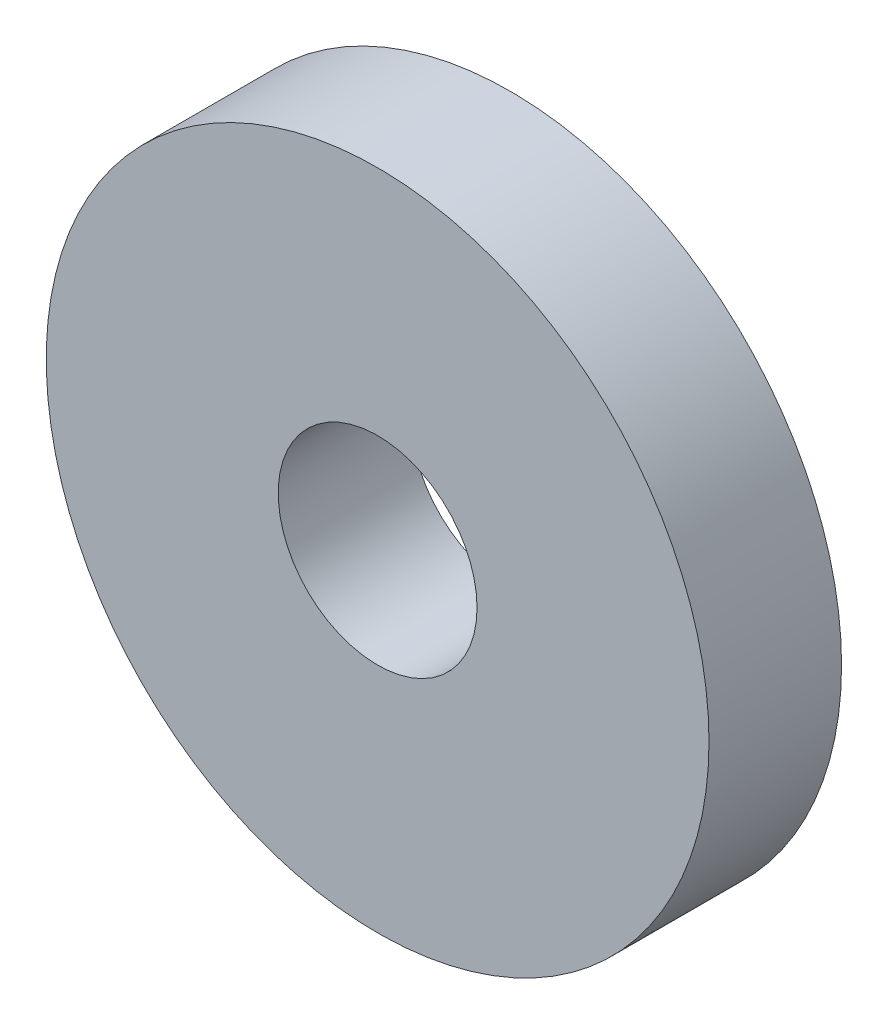
from build123d import *

# Parameters (mm, degrees)
SKETCH1_R           = 5
SKETCH1_R_2         = 1.5
BOSS_EXTRUDE1_DEPTH = 2


with BuildPart() as part:
    # Sketch1 → Boss-Extrude1 (new body)
    with BuildSketch(Plane.XY):
        with Locations((4.379476724, -5.578530543)):
            Circle(SKETCH1_R)
        with Locations((4.379476724, -5.578530543)):
            Circle(SKETCH1_R_2, mode=Mode.SUBTRACT)
    extrude(amount=BOSS_EXTRUDE1_DEPTH)


solid = part.part
